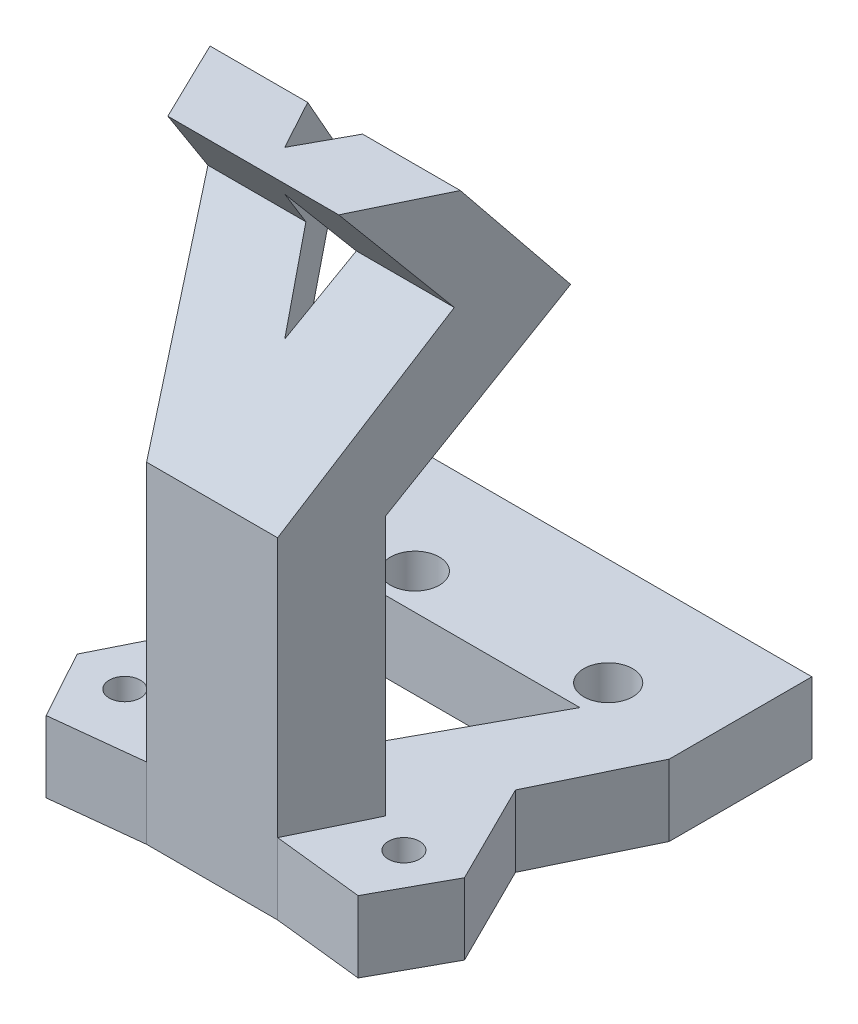
from build123d import *

# Parameters (mm, degrees)
SKETCH2_W           = 54.2
SKETCH2_H           = 20
BOSS_EXTRUDE1_DEPTH = 10
SKETCH4_R           = 2.1825
CUT_EXTRUDE1_DEPTH  = 10
BOSS_EXTRUDE2_DEPTH = 5
BOSS_EXTRUDE4_DEPTH = 28
CUT_EXTRUDE2_DEPTH  = 106
BOSS_EXTRUDE5_DEPTH = 5
BOSS_EXTRUDE6_DEPTH = 10
SKETCH16_R          = 2.1825
CUT_EXTRUDE4_DEPTH  = 10
SKETCH17_R          = 3.429638921
CUT_EXTRUDE5_DEPTH  = 8.6


with BuildPart() as part:
    # Sketch2 → Boss-Extrude1 (new body)
    with BuildSketch(Plane(origin=(0, 0, 0), x_dir=(1, 0, 0), z_dir=(0, 1, 0))):
        with Locations((0, 10)):
            Rectangle(SKETCH2_W, SKETCH2_H)
    extrude(amount=BOSS_EXTRUDE1_DEPTH)

    # Sketch4 → Cut-Extrude1 (cut)
    with BuildSketch(Plane(origin=(0, 10, 0), x_dir=(1, 0, 0), z_dir=(0, 1, 0))):
        with Locations(Location((13.55, 5, 0), (0, 0, 270))):
            Circle(SKETCH4_R)
        with Locations(Location((-13.55, 5, 0), (0, 0, 90))):
            Circle(SKETCH4_R)
    extrude(amount=-CUT_EXTRUDE1_DEPTH, mode=Mode.SUBTRACT)

    # Sketch5 → Boss-Extrude2 (add)
    with BuildSketch(Plane(origin=(0, 5, 0), x_dir=(1, 0, 0), z_dir=(0, 1, 0))):
        Polygon((-27.1, 0), (-9.18232636, -36.974160152), (9.18232636, -36.974160152), (27.1, 0), (14.580002835, 0), (0, -26.793067248), (-14.580002835, 0), align=None)
    extrude(amount=BOSS_EXTRUDE2_DEPTH)

    # Sketch10 → Boss-Extrude4 (add, symmetric)
    with BuildSketch(Plane(origin=(0, 0, 0), x_dir=(0, 0, -1), z_dir=(1, 0, 0))):
        Polygon((-26.793067248, 10), (-26.793067248, 46.4), (-9.305277317, 70.033391702), (-19.725473136, 84.115478139), (-31.200128156, 84.115478139), (-20.292138803, 70.059434974), (-36.974160152, 46.4), (-36.974160152, 10), align=None)
    extrude(amount=BOSS_EXTRUDE4_DEPTH, both=True)

    # Sketch12 → Cut-Extrude2 (cut)
    with BuildSketch(Plane(origin=(0, 0, 0), x_dir=(1, 0, 0), z_dir=(0, 1, 0))):
        Polygon((-14.580002835, 0), (14.580002835, 0), (0, -26.793067248), align=None)
        Polygon((-27.1, 0), (-9.18232636, -36.974160152), (9.18232636, -36.974160152), (27.1, 0), (46.03867266, -38.954692391), (-49.762484342, -38.954692391), align=None)
    extrude(amount=CUT_EXTRUDE2_DEPTH, mode=Mode.SUBTRACT)

    # Sketch14 → Boss-Extrude5 (add)
    with BuildSketch(Plane(origin=(0, 0, 0), x_dir=(1, 0, 0), z_dir=(0, 1, 0))):
        Polygon((-27.1, 0), (-9.18232636, -36.974160152), (9.18232636, -36.974160152), (27.1, 0), (14.580002835, 0), (0, -26.793067248), (-14.580002835, 0), align=None)
    extrude(amount=BOSS_EXTRUDE5_DEPTH)

    # Sketch15 → Boss-Extrude6 (add)
    with BuildSketch(Plane(origin=(0, 0, 0), x_dir=(1, 0, 0), z_dir=(0, 1, 0))):
        Polygon((20.065850881, -14.515375227), (27.146381487, -28.743465458), (21.865323293, -38.374718638), (9.18232636, -36.974160152), align=None)
        Polygon((-21.865323293, -38.374718638), (-9.18232636, -36.974160152), (-20.065850881, -14.515375227), (-27.146381487, -28.743465458), align=None)
    extrude(amount=BOSS_EXTRUDE6_DEPTH)

    # Sketch16 → Cut-Extrude4 (cut)
    with BuildSketch(Plane(origin=(0, 10, 0), x_dir=(1, 0, 0), z_dir=(0, 1, 0))):
        with Locations(Location((19.564970505, -29.651929869, 0), (0, 0, 270))):
            Circle(SKETCH16_R)
        with Locations(Location((-19.564970505, -29.651929869, 0), (0, 0, 90))):
            Circle(SKETCH16_R)
    extrude(amount=-CUT_EXTRUDE4_DEPTH, mode=Mode.SUBTRACT)

    # Sketch17 → Cut-Extrude5 (cut)
    with BuildSketch(Plane(origin=(0, 10, 0), x_dir=(1, 0, 0), z_dir=(0, 1, 0))):
        with Locations(Location((-13.55, 5, 0), (0, 0, 270))):
            Circle(SKETCH17_R)
        with Locations(Location((13.55, 5, 0), (0, 0, 270))):
            Circle(SKETCH17_R)
    extrude(amount=-CUT_EXTRUDE5_DEPTH, mode=Mode.SUBTRACT)


solid = part.part
